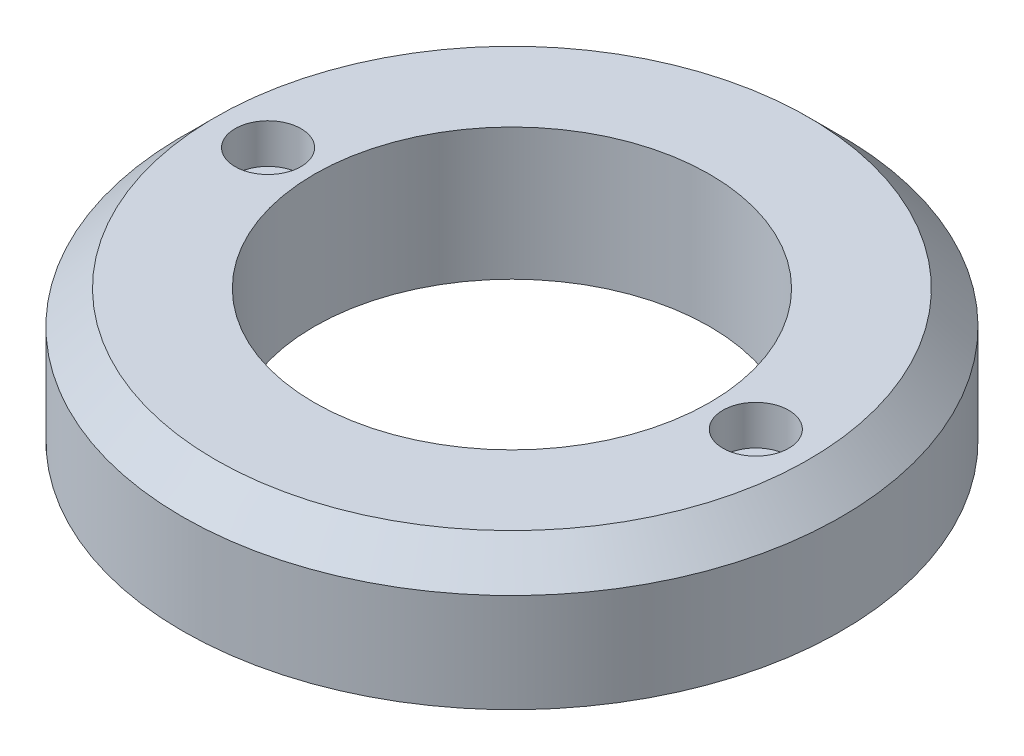
from build123d import *

# Parameters (mm, degrees)
SKETCH1_R                 = 50
SKETCH1_R_2               = 30
BOSS_EXTRUDE1_DEPTH       = 20
CHAMFER1_SIZE             = 5
M6X1_0_TAPPED_HOLE1_D     = 5
M6X1_0_TAPPED_HOLE1_DEPTH = 50
M6X1_0_TAPPED_HOLE1_TIP   = 1.502151548
SKETCH4_R                 = 5
CUT_EXTRUDE1_DEPTH        = 6


with BuildPart() as part:
    # Sketch1 → Boss-Extrude1 (new body)
    with BuildSketch(Plane(origin=(0, 0, 0), x_dir=(1, 0, 0), z_dir=(0, 1, 0))):
        with Locations(Location((0, 0, 0), (0, 0, 270))):
            Circle(SKETCH1_R)
        with Locations(Location((0, 0, 0), (0, 0, 270))):
            Circle(SKETCH1_R_2, mode=Mode.SUBTRACT)
    extrude(amount=BOSS_EXTRUDE1_DEPTH)

    # Chamfer1
    chamfer1_edges = [part.edges().sort_by_distance(p)[0] for p in [
        (0, 20, -50),
    ]]
    chamfer(chamfer1_edges, length=CHAMFER1_SIZE)

    # M6x1.0 Tapped Hole1
    with Locations(Plane(origin=(-37, 20, 0), x_dir=(0, 0, 1), z_dir=(0, 1, 0))):
        with Locations((0, 0), (0, 74)):
            Hole(M6X1_0_TAPPED_HOLE1_D / 2, depth=M6X1_0_TAPPED_HOLE1_DEPTH)
            with Locations((0, 0, -(M6X1_0_TAPPED_HOLE1_DEPTH + M6X1_0_TAPPED_HOLE1_TIP / 2))):  # 118° drill point
                Cone(0, M6X1_0_TAPPED_HOLE1_D / 2, M6X1_0_TAPPED_HOLE1_TIP, mode=Mode.SUBTRACT)

    # Sketch4 → Cut-Extrude1 (cut)
    with BuildSketch(Plane(origin=(0, 20, 0), x_dir=(1, 0, 0), z_dir=(0, 1, 0))):
        with Locations(Location((-37, 0, 0), (0, 0, 270))):
            Circle(SKETCH4_R)
        with Locations(Location((37, 0, 0), (0, 0, 270))):
            Circle(SKETCH4_R)
    extrude(amount=-CUT_EXTRUDE1_DEPTH, mode=Mode.SUBTRACT)


solid = part.part
